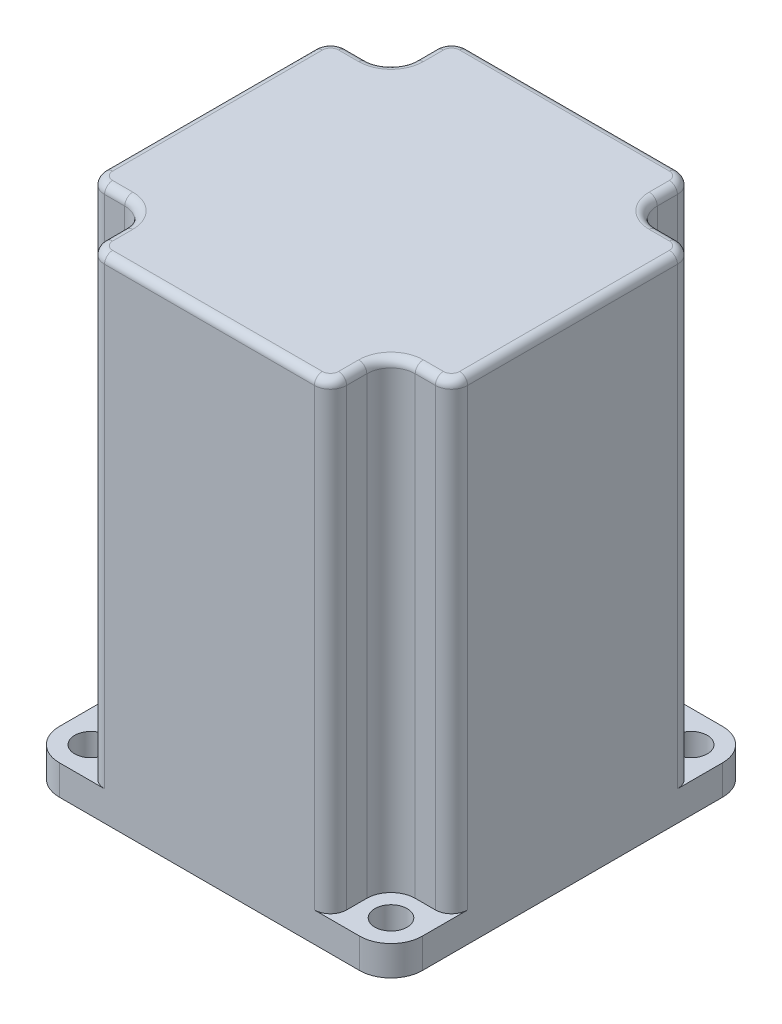
from build123d import *

# Parameters (mm, degrees)
SKETCH1_R           = 2.54
BOSS_EXTRUDE1_DEPTH = 4.699
BOSS_EXTRUDE2_DEPTH = 72.771
FILLET1_R           = 3.81
FILLET2_R           = 2.54
FILLET3_R           = 1.27
SKETCH3_R           = 19.05
BOSS_EXTRUDE3_DEPTH = 1.524
CUT_EXTRUDE1_START  = -6.35
SKETCH5_R           = 22.225
CUT_EXTRUDE1_DEPTH  = 66.802
SKETCH4_R           = 3.175
CUT_EXTRUDE4_DEPTH  = 12.7


with BuildPart() as part:
    # Sketch1 → Boss-Extrude1 (new body)
    with BuildSketch(Plane(origin=(0, 0, 0), x_dir=(1, 0, 0), z_dir=(0, 1, 0))):
        with BuildLine():
            Line((-23.622, 28.575), (23.622, 28.575))
            ThreePointArc((23.622, 28.575), (27.124299887, 27.124299887), (28.575, 23.622))
            Line((28.575, 23.622), (28.575, -23.622))
            ThreePointArc((28.575, -23.622), (27.124299887, -27.124299887), (23.622, -28.575))
            Line((23.622, -28.575), (-23.622, -28.575))
            ThreePointArc((-23.622, -28.575), (-27.124299887, -27.124299887), (-28.575, -23.622))
            Line((-28.575, -23.622), (-28.575, 23.622))
            ThreePointArc((-28.575, 23.622), (-27.124299887, 27.124299887), (-23.622, 28.575))
        make_face()
        with Locations(Location((-23.622, 23.622, 0), (0, 0, 270))):
            Circle(SKETCH1_R, mode=Mode.SUBTRACT)
        with Locations(Location((23.622, 23.622, 0), (0, 0, 270))):
            Circle(SKETCH1_R, mode=Mode.SUBTRACT)
        with Locations(Location((23.622, -23.622, 0), (0, 0, 270))):
            Circle(SKETCH1_R, mode=Mode.SUBTRACT)
        with Locations(Location((-23.622, -23.622, 0), (0, 0, 270))):
            Circle(SKETCH1_R, mode=Mode.SUBTRACT)
    extrude(amount=BOSS_EXTRUDE1_DEPTH)

    # Sketch2 → Boss-Extrude2 (add)
    with BuildSketch(Plane(origin=(0, 4.699, 0), x_dir=(1, 0, 0), z_dir=(0, 1, 0))):
        Polygon((-19.05, -28.575), (-19.05, -19.05), (-28.575, -19.05), (-28.575, 19.05), (-19.05, 19.05), (-19.05, 28.575), (19.05, 28.575), (19.05, 19.05), (28.575, 19.05), (28.575, -19.05), (19.05, -19.05), (19.05, -28.575), align=None)
    extrude(amount=BOSS_EXTRUDE2_DEPTH)

    # Fillet1
    fillet1_edges = [part.edges().sort_by_distance(p)[0] for p in [
        (-19.05, 41.0845, 19.05),
        (-19.05, 41.0845, -19.05),
        (19.05, 41.0845, -19.05),
        (19.05, 41.0845, 19.05),
    ]]
    fillet(fillet1_edges, radius=FILLET1_R)

    # Fillet2
    fillet2_edges = [part.edges().sort_by_distance(p)[0] for p in [
        (28.575, 41.0845, -19.05),
        (19.05, 41.0845, -28.575),
        (28.575, 41.0845, 19.05),
        (-19.05, 41.0845, -28.575),
        (-28.575, 41.0845, -19.05),
        (-19.05, 41.0845, 28.575),
        (-28.575, 41.0845, 19.05),
        (19.05, 41.0845, 28.575),
    ]]
    fillet(fillet2_edges, radius=FILLET2_R)

    # Fillet3
    fillet3_edges = [part.edges().sort_by_distance(p)[0] for p in [
        (24.4475, 77.47, -19.05),
        (28.575, 77.47, 0),
        (0, 77.47, 28.575),
        (19.05, 77.47, 24.4475),
        (0, 77.47, -28.575),
        (-19.05, 77.47, -24.4475),
        (-28.575, 77.47, 0),
        (-24.4475, 77.47, 19.05),
        (18.306051224, 77.47, 27.831051224),
        (-27.831051224, 77.47, 18.306051224),
        (-18.306051224, 77.47, 27.831051224),
        (-27.831051224, 77.47, -18.306051224),
        (-18.306051224, 77.47, -27.831051224),
        (27.831051224, 77.47, 18.306051224),
        (18.306051224, 77.47, -27.831051224),
        (27.831051224, 77.47, -18.306051224),
        (-19.05, 77.47, 24.4475),
        (-24.4475, 77.47, -19.05),
        (19.05, 77.47, -24.4475),
        (24.4475, 77.47, 19.05),
        (-20.165923164, 77.47, 20.165923164),
        (-20.165923164, 77.47, -20.165923164),
        (20.165923164, 77.47, -20.165923164),
        (20.165923164, 77.47, 20.165923164),
    ]]
    fillet(fillet3_edges, radius=FILLET3_R)

    # Sketch3 → Boss-Extrude3 (add)
    with BuildSketch(Plane.XZ):
        with Locations(Location((0, 0, 0), (0, 0, 90))):
            Circle(SKETCH3_R)
    extrude(amount=BOSS_EXTRUDE3_DEPTH)

    # Sketch5 → Cut-Extrude1 (cut)
    with BuildSketch(Plane.XZ.offset(CUT_EXTRUDE1_START)):
        with Locations(Location((0, 0, 0), (0, 0, 270))):
            Circle(SKETCH5_R)
    extrude(amount=-CUT_EXTRUDE1_DEPTH, mode=Mode.SUBTRACT)

    # Sketch4 → Cut-Extrude4 (cut)
    with BuildSketch(Plane.XZ.offset(1.524)):
        with Locations(Location((0, 0, 0), (0, 0, 270))):
            Circle(SKETCH4_R)
    extrude(amount=-CUT_EXTRUDE4_DEPTH, mode=Mode.SUBTRACT)


solid = part.part
